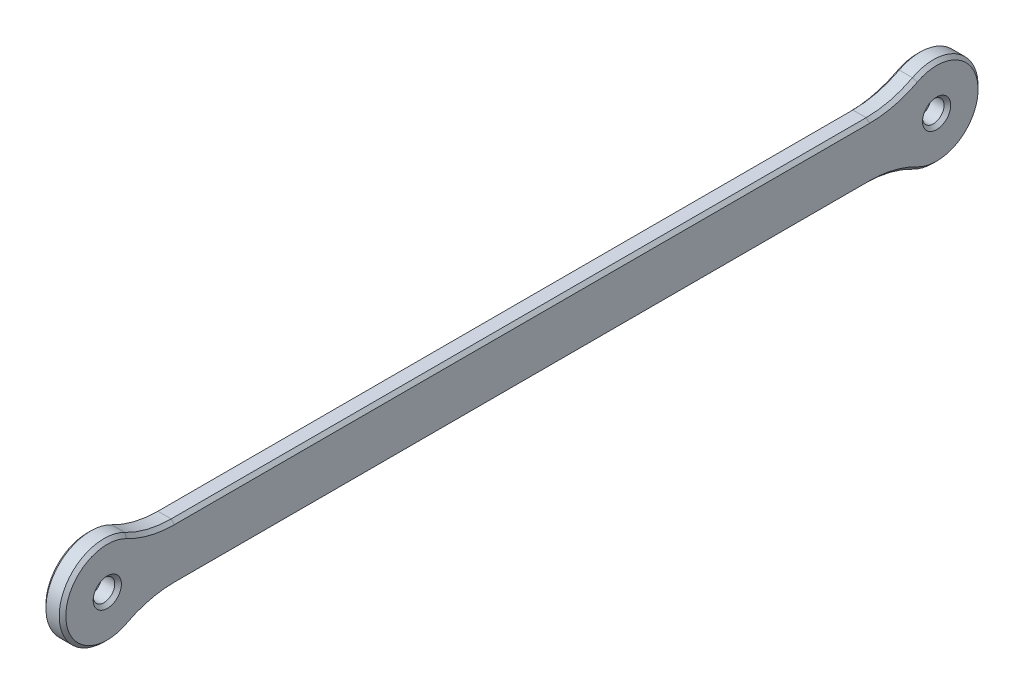
from build123d import *

# Parameters (mm, degrees)
SKETCH_1_R      = 1.625
EXTRUDE_1_DEPTH = 3
CHAMFER_1_SIZE  = 0.5
EXTRUDE_2_DEPTH = 3


with BuildPart() as part:
    # 草图1 → 凸台-拉伸1 (new body)
    with BuildSketch(Plane(origin=(-1.5, 0, 0), x_dir=(0, -1, 0), z_dir=(-1, 0, 0))):
        with BuildLine():
            Line((4.25, -52.375771634), (4.25, 52.375771634))
            ThreePointArc((4.25, 52.375771634), (4.687412128, 55.971746395), (5.974137931, 59.357998093))
            ThreePointArc((5.974137931, 59.357998093), (0, 69.25), (-5.974137931, 59.357998093))
            ThreePointArc((-5.974137931, 59.357998093), (-4.687412128, 55.971746395), (-4.25, 52.375771634))
            Line((-4.25, 52.375771634), (-4.25, -52.375771634))
            ThreePointArc((-4.25, -52.375771634), (-4.687412128, -55.971746395), (-5.974137931, -59.357998093))
            ThreePointArc((-5.974137931, -59.357998093), (0, -69.25), (5.974137931, -59.357998093))
            ThreePointArc((5.974137931, -59.357998093), (4.687412128, -55.971746395), (4.25, -52.375771634))
        make_face()
        with Locations(Location((0, -62.5, 0), (0, 0, 270))):
            Circle(SKETCH_1_R, mode=Mode.SUBTRACT)
        with Locations(Location((0, 62.5, 0), (0, 0, 270))):
            Circle(SKETCH_1_R, mode=Mode.SUBTRACT)
    extrude(amount=-EXTRUDE_1_DEPTH)

    # 倒角1
    chamfer_1_edges = [part.edges().sort_by_distance(p)[0] for p in [
        (-1.5, -4.25, 0),
        (-1.5, -4.687412128, -55.971746395),
        (-1.5, 0, -69.25),
        (-1.5, 4.687412128, -55.971746395),
        (1.5, -4.687412128, -55.971746395),
        (1.5, -4.25, 0),
        (1.5, -4.687412128, 55.971746395),
        (1.5, 0, -60.875),
        (-1.5, 0, -60.875),
        (1.5, 0, 69.25),
        (1.5, 0, 64.125),
        (-1.5, 0, 64.125),
        (1.5, 4.687412128, 55.971746395),
        (1.5, 4.25, 0),
        (1.5, 4.687412128, -55.971746395),
        (-1.5, 4.25, 0),
        (1.5, 0, -69.25),
        (-1.5, 4.687412128, 55.971746395),
        (-1.5, 0, 69.25),
        (-1.5, -4.687412128, 55.971746395),
    ]]
    chamfer(chamfer_1_edges, length=CHAMFER_1_SIZE)

    # Sketch 3D_1 → 凸台-拉伸2 (add)
    with BuildSketch(Plane(origin=(-1.5, 1.411337563, 55.448843226), x_dir=(0, -0.022148278790467303, -0.9997546967864767), z_dir=(1, 0, 0))):
        Polygon((0, 0), (110.093393882, 2.43897747), (110.147426289, 0), (0.054032407, -2.43897747), align=None)
    extrude(amount=EXTRUDE_2_DEPTH)


solid = part.part
